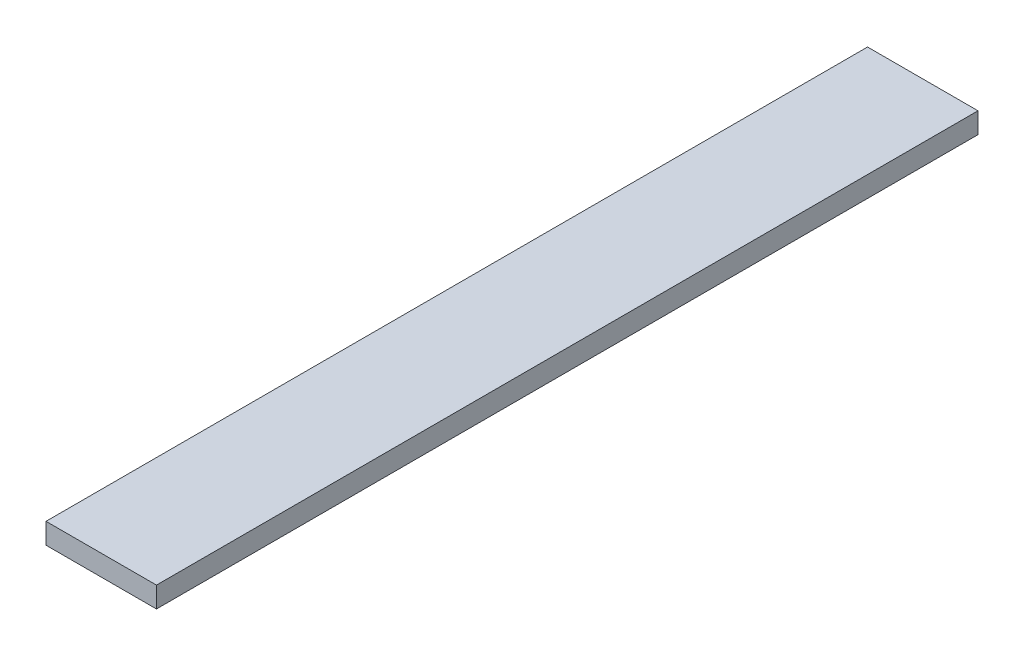
from build123d import *

# Parameters (mm, degrees)
SKETCH1_W           = 101.6
SKETCH1_H           = 755.65
BOSS_EXTRUDE1_DEPTH = 19.05


with BuildPart() as part:
    # Sketch1 → Boss-Extrude1 (new body)
    with BuildSketch(Plane(origin=(0, 0, 0), x_dir=(1, 0, 0), z_dir=(0, 1, 0))):
        with Locations((-167.817974573, -450.360324797)):
            Rectangle(SKETCH1_W, SKETCH1_H)
    extrude(amount=BOSS_EXTRUDE1_DEPTH)


solid = part.part
